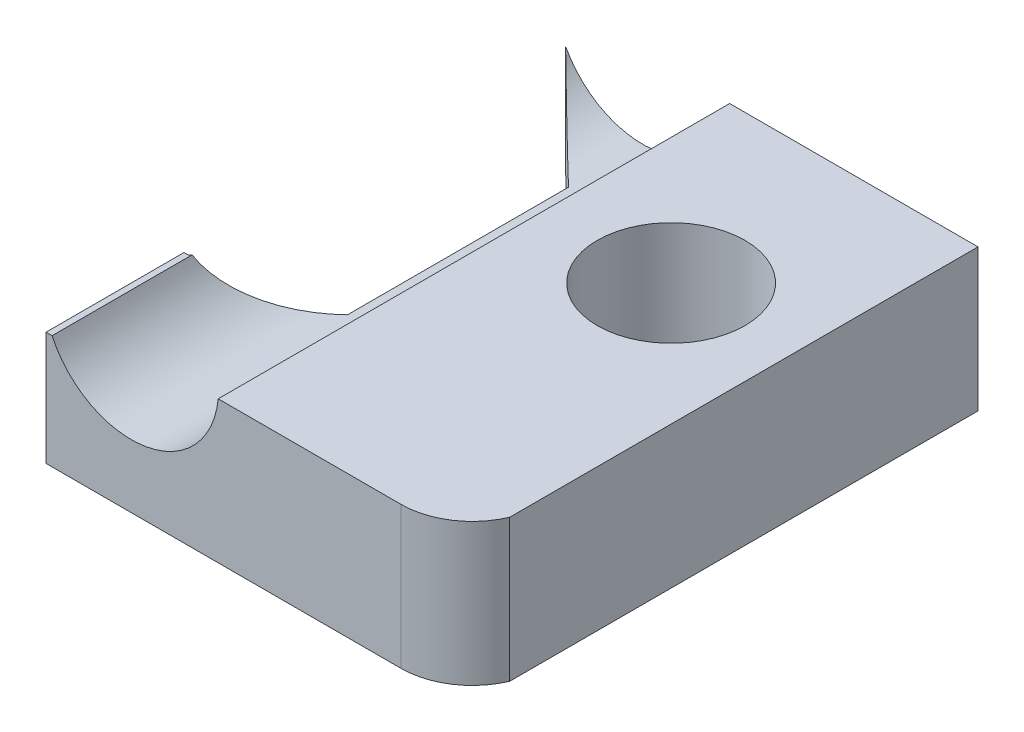
from build123d import *

# Parameters (mm, degrees)
BOSS_EXTRUDE1_DEPTH      = 5
BOSS_EXTRUDE1_DEPTH_BACK = 0.0001
SKETCH1_R                = 2.6
SKETCH2_R                = 3.075
CUT_EXTRUDE1_DEPTH       = 24.958297101
FILLET1_R                = 2.5
SKETCH3_W                = 0.717338371
SKETCH3_H                = 1
CUT_EXTRUDE2_DEPTH       = 24.958297101
SKETCH4_W                = 0.2
SKETCH4_H                = 18
CUT_EXTRUDE3_DEPTH       = 24.958317971


with BuildPart() as part:
    # Sketch1 → Boss-Extrude1 (new, two sides: drawn at the far end of the back side and taken through both)
    with BuildSketch(Plane(origin=(0, 0, 0), x_dir=(1, 0, 0), z_dir=(0, 1, 0)).offset(-BOSS_EXTRUDE1_DEPTH_BACK)):
        Polygon((0, 18), (2.8, 15.304069131), (2.8, 7.695628029), (0, 5), (0, 0), (15, 0), (15, 18), align=None)
        with Locations(Location((10.5, 11.499529694, 0), (0, 0, 270))):
            Circle(SKETCH1_R, mode=Mode.SUBTRACT)
    extrude(amount=BOSS_EXTRUDE1_DEPTH + BOSS_EXTRUDE1_DEPTH_BACK)

    # Sketch2 → Cut-Extrude1 (cut, through all)
    with BuildSketch(Plane.XY):
        with Locations((3, 5.3)):
            Circle(SKETCH2_R)
    extrude(amount=-CUT_EXTRUDE1_DEPTH, mode=Mode.SUBTRACT)

    # Fillet1
    fillet1_edges = [part.edges().sort_by_distance(p)[0] for p in [
        (15, 2.49995, 0),
    ]]
    fillet(fillet1_edges, radius=FILLET1_R)

    # Sketch3 → Cut-Extrude2 (cut, through all)
    with BuildSketch(Plane.XY):
        with Locations((0.358669186, 4.5)):
            Rectangle(SKETCH3_W, SKETCH3_H)
    extrude(amount=-CUT_EXTRUDE2_DEPTH, mode=Mode.SUBTRACT)

    # Sketch4 → Cut-Extrude3 (cut, through all)
    with BuildSketch(Plane.XZ.offset(0.0001)):
        Polygon((0.138710494, -4.855918777), (-0.903561635, -4.855918777), (-0.903561635, -18.144073437), (0.138718581, -18.144073437), (3, -15.389138829), (3, -7.610551703), align=None)
        with Locations((14.9, -9)):
            Rectangle(SKETCH4_W, SKETCH4_H)
    extrude(amount=-CUT_EXTRUDE3_DEPTH, mode=Mode.SUBTRACT)


solid = part.part
